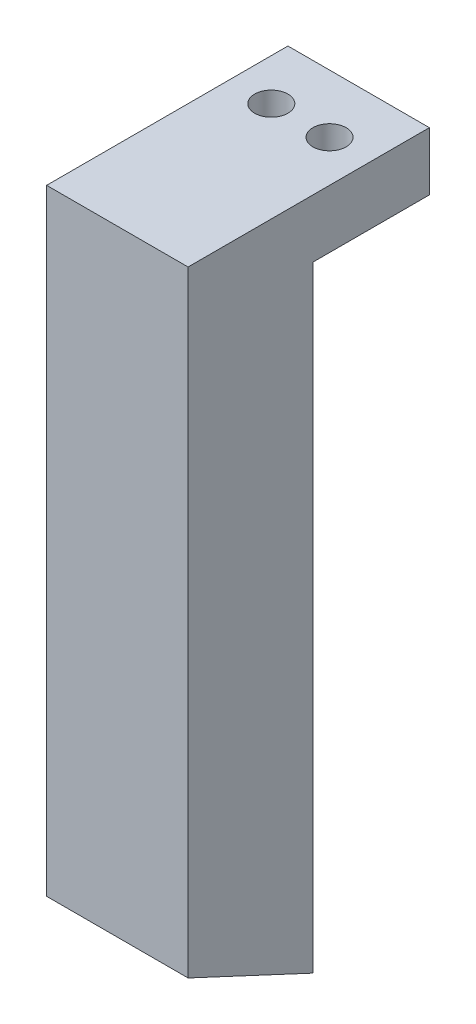
from build123d import *

# Parameters (mm, degrees)
SKETCH1_W           = 17
SKETCH1_H           = 15
BOSS_EXTRUDE1_DEPTH = 81
CUT_EXTRUDE1_DEPTH  = 40
SKETCH3_R           = 1.5
CUT_EXTRUDE2_DEPTH  = 36
SKETCH4_W           = 17
SKETCH4_H           = 7
BOSS_EXTRUDE2_DEPTH = 14
SKETCH5_R           = 2
CUT_EXTRUDE3_DEPTH  = 14


with BuildPart() as part:
    # Sketch1 → Boss-Extrude1 (new body)
    with BuildSketch(Plane(origin=(0, 0, 0), x_dir=(1, 0, 0), z_dir=(0, 1, 0))):
        with Locations((-68.404761905, 8.571428571)):
            Rectangle(SKETCH1_W, SKETCH1_H)
    extrude(amount=BOSS_EXTRUDE1_DEPTH)

    # Sketch2 → Cut-Extrude1 (cut)
    with BuildSketch(Plane(origin=(-59.904761905, 0, 0), x_dir=(0, 0, -1), z_dir=(1, 0, 0))):
        Polygon((16.071428571, 0), (1.071428571, 0), (1.071428571, 6.994614872), align=None)
    extrude(amount=-CUT_EXTRUDE1_DEPTH, mode=Mode.SUBTRACT)

    # Sketch3 → Cut-Extrude2 (cut)
    with BuildSketch(Plane(origin=(0, 6.155714275, -2.870456708), x_dir=(1, 0, 0), z_dir=(0, -0.9063077870366528, 0.4226182617406934))):
        with Locations(Location((-68.404761905, -5.514992079, 0), (0, 0, 270))):
            Circle(SKETCH3_R)
    extrude(amount=-CUT_EXTRUDE2_DEPTH, mode=Mode.SUBTRACT)

    # Sketch4 → Boss-Extrude2 (add)
    with BuildSketch(Plane(origin=(0, 0, -16.071428571), x_dir=(-1, 0, 0), z_dir=(0, 0, -1))):
        with Locations((68.404761905, 77.5)):
            Rectangle(SKETCH4_W, SKETCH4_H)
    extrude(amount=BOSS_EXTRUDE2_DEPTH)

    # Sketch5 → Cut-Extrude3 (cut)
    with BuildSketch(Plane(origin=(0, 74, 0), x_dir=(-1, 0, 0), z_dir=(0, -1, 0))):
        with Locations(Location((71.904761905, 23.071428571, 0), (0, 0, 90))):
            Circle(SKETCH5_R)
        with Locations(Location((64.904761905, 23.071428571, 0), (0, 0, 90))):
            Circle(SKETCH5_R)
    extrude(amount=-CUT_EXTRUDE3_DEPTH, mode=Mode.SUBTRACT)


solid = part.part
